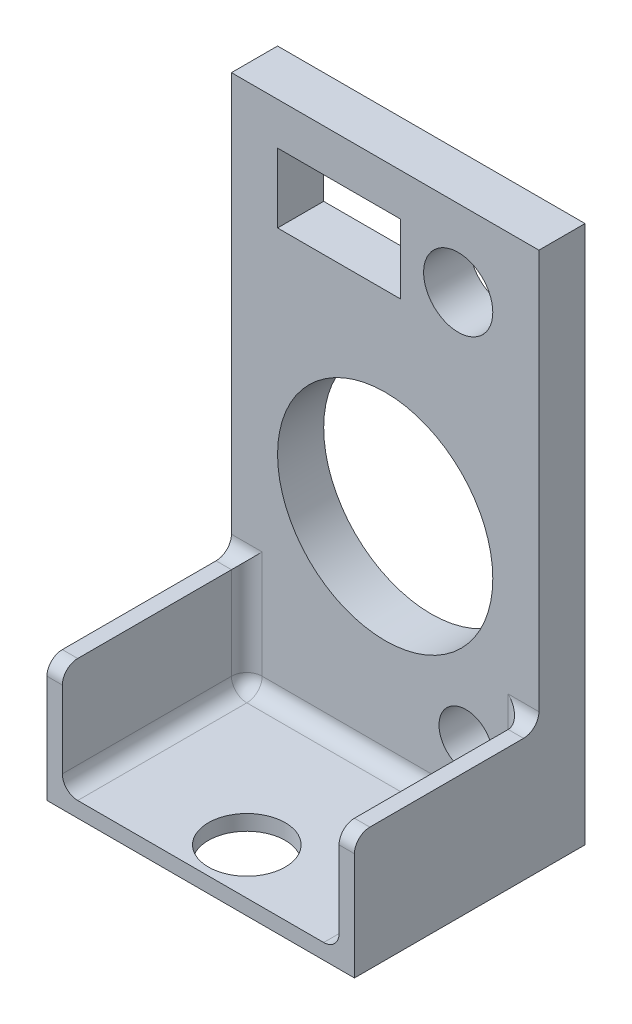
from build123d import *

# Parameters (mm, degrees)
SKETCH1_7_W         = 20
SKETCH1_7_H         = 35
SKETCH1_7_R         = 2.25
SKETCH1_7_W_2       = 8
SKETCH1_7_H_2       = 4.5
SKETCH1_7_R_2       = 1.75
SKETCH1_7_R_3       = 7
BOSS_EXTRUDE2_DEPTH = 3
BOSS_EXTRUDE3_DEPTH = 12
SKETCH2_R           = 2.5
CUT_EXTRUDE1_DEPTH  = 43.05948169
FILLET1_R           = 1


with BuildPart() as part:
    # Sketch1<7> → Boss-Extrude2 (new body)
    with BuildSketch(Plane.XY):
        with Locations((10, 37.5)):
            Rectangle(SKETCH1_7_W, SKETCH1_7_H)
        with Locations((14.75, 50)):
            Circle(SKETCH1_7_R, mode=Mode.SUBTRACT)
        with Locations((7, 50)):
            Rectangle(SKETCH1_7_W_2, SKETCH1_7_H_2, mode=Mode.SUBTRACT)
        with Locations((15.25, 25)):
            Circle(SKETCH1_7_R_2, mode=Mode.SUBTRACT)
        with Locations((10, 35)):
            Circle(SKETCH1_7_R_3, mode=Mode.SUBTRACT)
    extrude(amount=-BOSS_EXTRUDE2_DEPTH)

    # Sketch1<8> → Boss-Extrude3 (add)
    with BuildSketch(Plane.XY):
        Polygon((0, 28), (0, 20), (20, 20), (20, 28), (19, 28), (19, 21), (1, 21), (1, 28), align=None)
    extrude(amount=BOSS_EXTRUDE3_DEPTH)

    # Sketch2 → Cut-Extrude1 (cut, through all)
    with BuildSketch(Plane.XZ.offset(-20)):
        with Locations((10, 9)):
            Circle(SKETCH2_R)
    extrude(amount=-CUT_EXTRUDE1_DEPTH, mode=Mode.SUBTRACT)

    # Fillet1
    fillet1_edges = [part.edges().sort_by_distance(p)[0] for p in [
        (19.5, 28, 12),
        (0.5, 28, 12),
        (1, 24.5, 0),
        (19, 24.5, 0),
        (19, 21, 6),
        (10, 21, 0),
        (1, 21, 6),
        (19.5, 28, 0),
        (0.5, 28, 0),
    ]]
    fillet(fillet1_edges, radius=FILLET1_R)


solid = part.part
